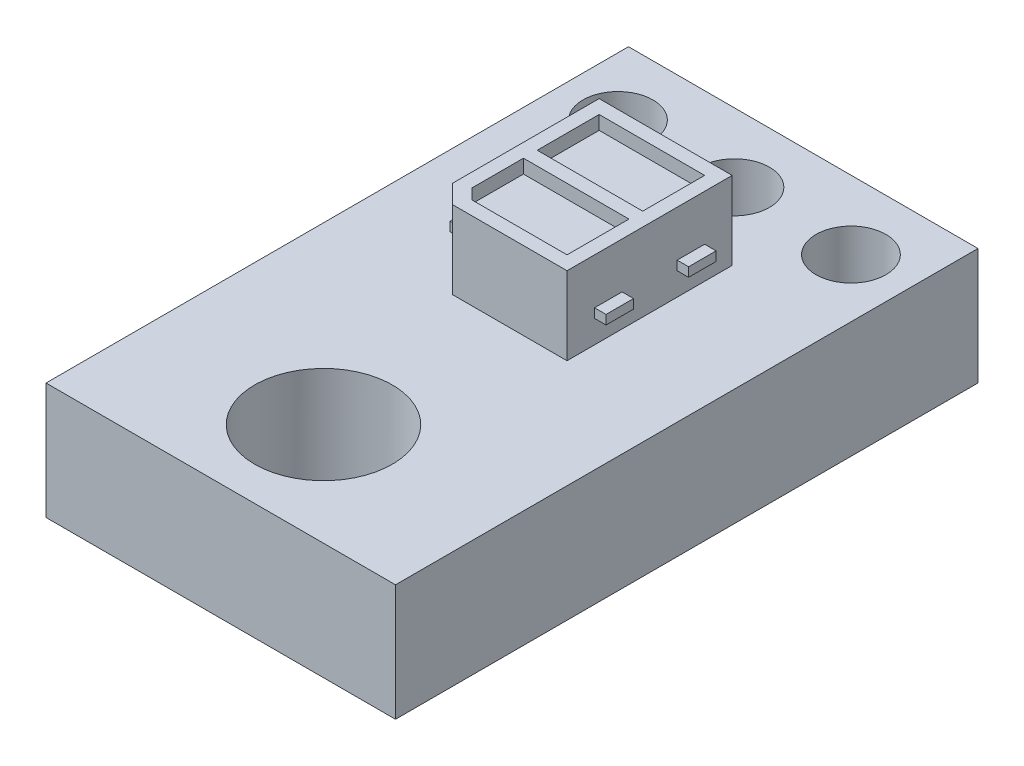
from build123d import *

# Parameters (mm, degrees)
BOSS_EXTRUDE1_DEPTH = 1.7
SKETCH2_W           = 2.3
SKETCH2_H           = 1.35
CUT_EXTRUDE1_DEPTH  = 0.3
SKETCH3_W           = 0.6
SKETCH3_H           = 0.2
BOSS_EXTRUDE2_DEPTH = 0.25
SKETCH8_W           = 0.6
SKETCH8_H           = 0.2
BOSS_EXTRUDE3_DEPTH = 0.25
SKETCH9_W           = 7.62
SKETCH9_H           = 12.7
BOSS_EXTRUDE4_DEPTH = 2.54
CUT_EXTRUDE2_REACH  = 11.131
SKETCH10_R          = 0.762
SKETCH10_R_2        = 1.5


with BuildPart() as part:
    # Sketch1 → Boss-Extrude1 (new body)
    with BuildSketch(Plane(origin=(0, 0, 0), x_dir=(1, 0, 0), z_dir=(0, 1, 0))):
        Polygon((-1.45, 1.8), (1.45, 1.8), (1.45, -1.8), (-1.05, -1.8), (-1.45, -1.4), align=None)
    extrude(amount=-BOSS_EXTRUDE1_DEPTH)

    # Sketch2 → Cut-Extrude1 (cut)
    with BuildSketch(Plane(origin=(0, 0, 0), x_dir=(1, 0, 0), z_dir=(0, 1, 0))):
        with Locations((0, 0.825)):
            Rectangle(SKETCH2_W, SKETCH2_H)
        Polygon((-1.15, -0.15), (1.15, -0.15), (1.15, -1.5), (-0.925735931, -1.5), (-1.15, -1.275735931), align=None)
    extrude(amount=-CUT_EXTRUDE1_DEPTH, mode=Mode.SUBTRACT)

    # Sketch3 → Boss-Extrude2 (add)
    with BuildSketch(Plane.ZY.offset(1.45)):
        with Locations((-0.9, -1.04)):
            Rectangle(SKETCH3_W, SKETCH3_H)
        with Locations((0.9, -1.04)):
            Rectangle(SKETCH3_W, SKETCH3_H)
    extrude(amount=BOSS_EXTRUDE2_DEPTH)

    # Sketch8 → Boss-Extrude3 (add)
    with BuildSketch(Plane(origin=(1.45, 0, 0), x_dir=(0, 0, -1), z_dir=(1, 0, 0))):
        with Locations((-0.9, -1.1)):
            Rectangle(SKETCH8_W, SKETCH8_H)
        with Locations((0.9, -1.1)):
            Rectangle(SKETCH8_W, SKETCH8_H)
    extrude(amount=BOSS_EXTRUDE3_DEPTH)

    # Sketch9 → Boss-Extrude4 (add)
    with BuildSketch(Plane.XZ.offset(1.7)):
        with Locations((0, 1.55)):
            Rectangle(SKETCH9_W, SKETCH9_H)
    extrude(amount=BOSS_EXTRUDE4_DEPTH)

    # Sketch10 → Cut-Extrude2 (cut, up to next)
    with BuildSketch(Plane(origin=(0, -1.7, 0), x_dir=(1, 0, 0), z_dir=(0, 1, 0)), mode=Mode.PRIVATE) as cut_extrude2_sk1:
        with Locations(Location((0, 3.3, 0), (0, 0, 270))):
            Circle(SKETCH10_R)
    cut_extrude2_tool1 = extrude(cut_extrude2_sk1.sketch, amount=-CUT_EXTRUDE2_REACH, mode=Mode.PRIVATE) & part.part
    # Sketch10 → Cut-Extrude2 (cut, up to next)
    with BuildSketch(Plane(origin=(0, -1.7, 0), x_dir=(1, 0, 0), z_dir=(0, 1, 0)), mode=Mode.PRIVATE) as cut_extrude2_sk2:
        with Locations(Location((2.54, 3.3, 0), (0, 0, 270))):
            Circle(SKETCH10_R)
    cut_extrude2_tool2 = extrude(cut_extrude2_sk2.sketch, amount=-CUT_EXTRUDE2_REACH, mode=Mode.PRIVATE) & part.part
    # Sketch10 → Cut-Extrude2 (cut, up to next)
    with BuildSketch(Plane(origin=(0, -1.7, 0), x_dir=(1, 0, 0), z_dir=(0, 1, 0)), mode=Mode.PRIVATE) as cut_extrude2_sk3:
        with Locations(Location((-2.54, 3.3, 0), (0, 0, 90))):
            Circle(SKETCH10_R)
    cut_extrude2_tool3 = extrude(cut_extrude2_sk3.sketch, amount=-CUT_EXTRUDE2_REACH, mode=Mode.PRIVATE) & part.part
    # Sketch10 → Cut-Extrude2 (cut, up to next)
    with BuildSketch(Plane(origin=(0, -1.7, 0), x_dir=(1, 0, 0), z_dir=(0, 1, 0)), mode=Mode.PRIVATE) as cut_extrude2_sk4:
        with Locations(Location((0, -5.66, 0), (0, 0, 270))):
            Circle(SKETCH10_R_2)
    cut_extrude2_tool4 = extrude(cut_extrude2_sk4.sketch, amount=-CUT_EXTRUDE2_REACH, mode=Mode.PRIVATE) & part.part
    add(cut_extrude2_tool1.solids().sort_by_distance((0, -1.7, -3.3))[0], mode=Mode.SUBTRACT)
    add(cut_extrude2_tool2.solids().sort_by_distance((2.54, -1.7, -3.3))[0], mode=Mode.SUBTRACT)
    add(cut_extrude2_tool3.solids().sort_by_distance((-2.54, -1.7, -3.3))[0], mode=Mode.SUBTRACT)
    add(cut_extrude2_tool4.solids().sort_by_distance((0, -1.7, 5.66))[0], mode=Mode.SUBTRACT)


solid = part.part
